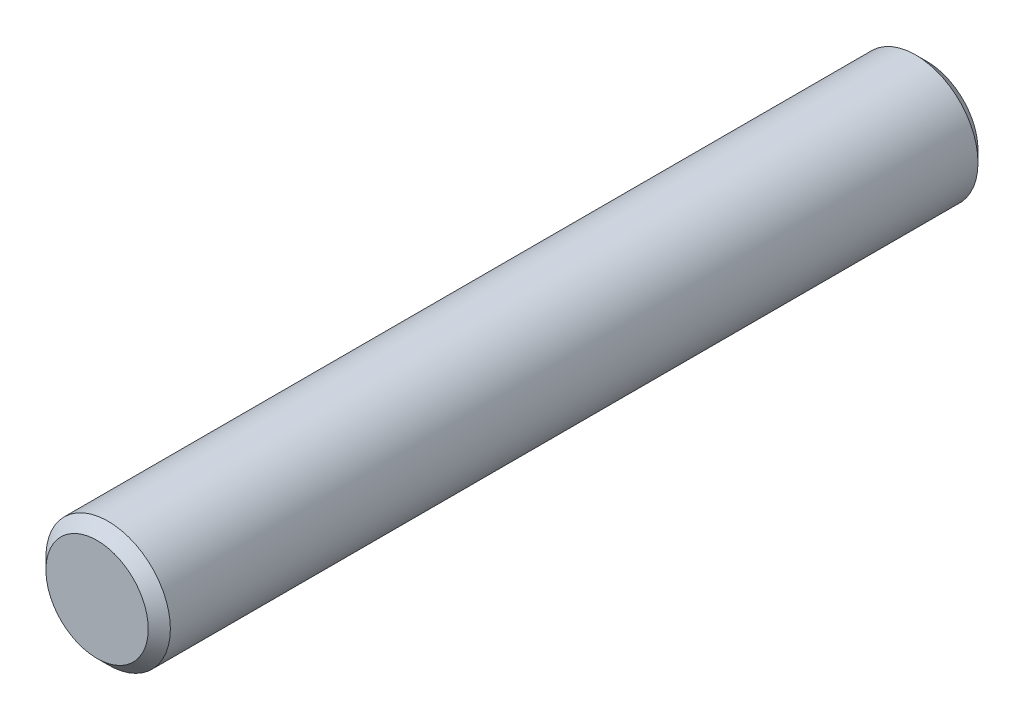
from build123d import *

# Parameters (mm, degrees)
SKETCH1_R           = 4.5
BOSS_EXTRUDE1_DEPTH = 60
CHAMFER1_SIZE       = 0.8


with BuildPart() as part:
    # Sketch1 → Boss-Extrude1 (new body)
    with BuildSketch(Plane.XY):
        Circle(SKETCH1_R)
    extrude(amount=BOSS_EXTRUDE1_DEPTH)

    # Chamfer1
    chamfer1_edges = [part.edges().sort_by_distance(p)[0] for p in [
        (-4.5, 0, 0),
        (-4.5, 0, 60),
    ]]
    chamfer(chamfer1_edges, length=CHAMFER1_SIZE)


solid = part.part
